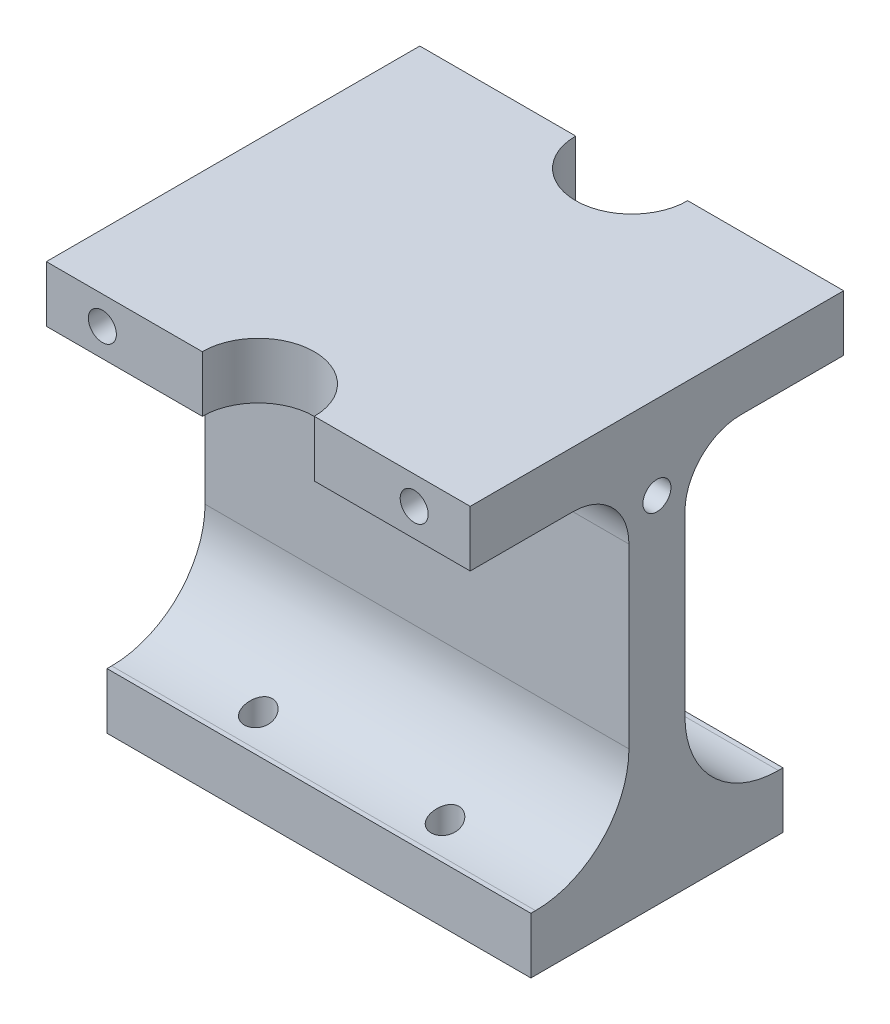
from build123d import *

# Parameters (mm, degrees)
SKETCH1_W                    = 45.4
SKETCH1_H                    = 27
BOSS_EXTRUDE1_DEPTH          = 6
SKETCH4_W                    = 45.4
SKETCH4_H                    = 6
BOSS_EXTRUDE2_DEPTH          = 35
FILLET3_R                    = 10
F_3_0MM_DOWEL_HOLE1_D        = 3
BOSS_EXTRUDE3_DEPTH          = 6
FILLET4_R                    = 6
F_3_0_3_DIAMETER_HOLE1_D     = 3
F_3_0_3_DIAMETER_HOLE1_DEPTH = 6
F_3_0_3_DIAMETER_HOLE1_TIP   = 0.901290929
F_3_0_3_DIAMETER_HOLE2_D     = 3
F_3_0_3_DIAMETER_HOLE2_DEPTH = 6
F_3_0_3_DIAMETER_HOLE2_TIP   = 0.901290929


with BuildPart() as part:
    # Sketch1 → Boss-Extrude1 (new body)
    with BuildSketch(Plane(origin=(0, 0, 0), x_dir=(1, 0, 0), z_dir=(0, 1, 0))):
        with Locations((22.7, 13.5)):
            Rectangle(SKETCH1_W, SKETCH1_H)
    extrude(amount=BOSS_EXTRUDE1_DEPTH)

    # Sketch4 → Boss-Extrude2 (add)
    with BuildSketch(Plane(origin=(0, 6, 0), x_dir=(1, 0, 0), z_dir=(0, 1, 0))):
        with Locations((22.7, 13.5)):
            Rectangle(SKETCH4_W, SKETCH4_H)
    extrude(amount=BOSS_EXTRUDE2_DEPTH)

    # Fillet3
    fillet3_edges = [part.edges().sort_by_distance(p)[0] for p in [
        (22.7, 6, -10.5),
        (22.7, 6, -16.5),
    ]]
    fillet(fillet3_edges, radius=FILLET3_R)

    # Ø3.0mm Dowel Hole1 (through all)
    with Locations(Plane(origin=(0, 16, 0), x_dir=(1, 0, 0), z_dir=(0, 1, 0))):
        with Locations((12.7, 23.5), (32.7, 23.5), (32.7, 3.5), (12.7, 3.5)):
            Hole(F_3_0MM_DOWEL_HOLE1_D / 2)

    # Sketch5 → Boss-Extrude3 (add)
    with BuildSketch(Plane(origin=(0, 41, 0), x_dir=(1, 0, 0), z_dir=(0, 1, 0))):
        with BuildLine():
            Line((45.4, 33.5), (28.7, 33.5))
            ThreePointArc((28.7, 33.5), (22.7, 27.5), (16.7, 33.5))
            Line((16.7, 33.5), (0, 33.5))
            Line((0, 33.5), (0, -6.5))
            Line((0, -6.5), (16.7, -6.5))
            ThreePointArc((16.7, -6.5), (22.7, -0.5), (28.7, -6.5))
            Line((28.7, -6.5), (45.4, -6.5))
            Line((45.4, -6.5), (45.4, 33.5))
        make_face()
    extrude(amount=BOSS_EXTRUDE3_DEPTH)

    # Fillet4
    fillet4_edges = [part.edges().sort_by_distance(p)[0] for p in [
        (22.7, 41, -10.5),
        (22.7, 41, -16.5),
    ]]
    fillet(fillet4_edges, radius=FILLET4_R)

    # Ø3.0 (3) Diameter Hole1
    with Locations(Plane.XY.offset(6.5)):
        with Locations((6, 44), (39.4, 44)):
            Hole(F_3_0_3_DIAMETER_HOLE1_D / 2, depth=F_3_0_3_DIAMETER_HOLE1_DEPTH)
            with Locations((0, 0, -(F_3_0_3_DIAMETER_HOLE1_DEPTH + F_3_0_3_DIAMETER_HOLE1_TIP / 2))):  # 118° drill point
                Cone(0, F_3_0_3_DIAMETER_HOLE1_D / 2, F_3_0_3_DIAMETER_HOLE1_TIP, mode=Mode.SUBTRACT)

    # Ø3.0 (3) Diameter Hole2
    with Locations(Plane(origin=(0, 0, -33.5), x_dir=(-1, 0, 0), z_dir=(0, 0, -1))):
        with Locations((-39.4, 44), (-6, 44)):
            Hole(F_3_0_3_DIAMETER_HOLE2_D / 2, depth=F_3_0_3_DIAMETER_HOLE2_DEPTH)
            with Locations((0, 0, -(F_3_0_3_DIAMETER_HOLE2_DEPTH + F_3_0_3_DIAMETER_HOLE2_TIP / 2))):  # 118° drill point
                Cone(0, F_3_0_3_DIAMETER_HOLE2_D / 2, F_3_0_3_DIAMETER_HOLE2_TIP, mode=Mode.SUBTRACT)

    # Sketch12 → Ø3.0 (3) Diameter Hole3 (revolve, cut)
    with BuildSketch(Plane(origin=(45.4, 38, -13.5), x_dir=(0, 0, -1), z_dir=(0, 1, 0))):
        Polygon((0, 0), (0, 12.901290929), (1.5, 12), (1.5, 0), align=None)
    f_3_0_3_diameter_hole3 = revolve(axis=Axis((51.75, 38, -13.5), (-1, 0, 0)), mode=Mode.SUBTRACT)

    # Mirror1: Ø3.0 (3) Diameter Hole3 across plane
    add(f_3_0_3_diameter_hole3.mirror(Plane.ZY.offset(-22.7)), mode=Mode.SUBTRACT)


solid = part.part
